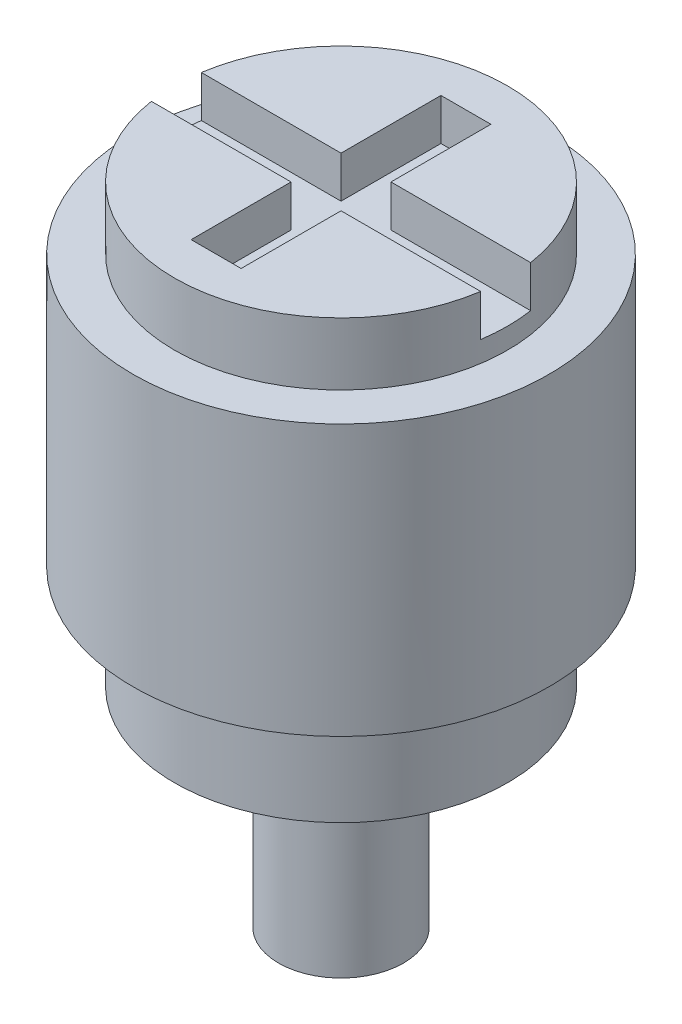
from build123d import *
from build123d.topology import SkipClean

# Parameters (mm, degrees)
SKETCH_1_R          = 1.5
EXTRUDE_1_DEPTH     = 5
SKETCH_6_R          = 5
EXTRUDE_1_2_DEPTH   = 9
SKETCH_2_R          = 4
EXTRUDE_2_DEPTH     = 1.5
SKETCH_3_W          = 8.364260008
SKETCH_3_H          = 1.2
CUT_EXTRUDE_1_DEPTH = 1
SKETCH_4_W          = 1.2
SKETCH_4_H          = 6
CUT_EXTRUDE_2_DEPTH = 1
SKETCH_7_R          = 3
SKETCH_7_R_2        = 1.5
CUT_EXTRUDE_3_DEPTH = 2
SKETCH_8_OUTSIDE_W  = 16.196
SKETCH_8_OUTSIDE_H  = 16.196
SKETCH_8_OUTSIDE_R  = 4
CUT_EXTRUDE_4_DEPTH = 2.5


with BuildPart() as part:
    # 草图1 → Extrude 1 (new body)
    with BuildSketch(Plane(origin=(0, 0, 0), x_dir=(1, 0, 0), z_dir=(0, 1, 0))):
        with Locations(Location((0, 0, 0), (0, 0, 270))):
            Circle(SKETCH_1_R)
    extrude(amount=EXTRUDE_1_DEPTH)

    # 草图6 → Extrude 1 2 (add)
    with BuildSketch(Plane(origin=(0, 5, 0), x_dir=(1, 0, 0), z_dir=(0, 1, 0))):
        with Locations(Location((0, 0, 0), (0, 0, 270))):
            Circle(SKETCH_6_R)
    extrude(amount=EXTRUDE_1_2_DEPTH)

    # 草图2 → 拉伸2 (add)
    with BuildSketch(Plane(origin=(0, 14, 0), x_dir=(-1, 0, 0), z_dir=(0, 1, 0))):
        with Locations(Location((0, 0, 0), (0, 0, 90))):
            Circle(SKETCH_2_R)
    extrude(amount=EXTRUDE_2_DEPTH)

    # 草图3 → 切除-拉伸1 (cut)
    with BuildSketch(Plane(origin=(0, 15.5, 0), x_dir=(-1, 0, 0), z_dir=(0, 1, 0))):
        Rectangle(SKETCH_3_W, SKETCH_3_H)
    extrude(amount=-CUT_EXTRUDE_1_DEPTH, mode=Mode.SUBTRACT)

    # 草图4 → 切除-拉伸2 (cut)
    with BuildSketch(Plane(origin=(0, 15.5, 0), x_dir=(-1, 0, 0), z_dir=(0, 1, 0))):
        Rectangle(SKETCH_4_W, SKETCH_4_H)
    extrude(amount=-CUT_EXTRUDE_2_DEPTH, mode=Mode.SUBTRACT)

    # 草图7 → 切除-拉伸3 (cut)
    with SkipClean():  # the faces are left unmerged after this step: merging them gives an invalid solid
        with BuildSketch(Plane.XZ.offset(-5)):
            with Locations(Location((0, 0, 0), (0, 0, 270))):
                Circle(SKETCH_7_R)
            with Locations(Location((0, 0, 0), (0, 0, 270))):
                Circle(SKETCH_7_R_2, mode=Mode.SUBTRACT)
        extrude(amount=-CUT_EXTRUDE_3_DEPTH, mode=Mode.SUBTRACT)

    # 草图8 outside → 切除-拉伸4 (cut)
    with SkipClean():  # the faces are left unmerged after this step: merging them gives an invalid solid
        with BuildSketch(Plane(origin=(0, 5, 0), x_dir=(-1, 0, 0), z_dir=(0, -1, 0))):
            Rectangle(SKETCH_8_OUTSIDE_W, SKETCH_8_OUTSIDE_H)
            with Locations(Location((0, 0, 0), (0, 0, 90))):
                Circle(SKETCH_8_OUTSIDE_R, mode=Mode.SUBTRACT)
        extrude(amount=-CUT_EXTRUDE_4_DEPTH, mode=Mode.SUBTRACT)


solid = part.part
